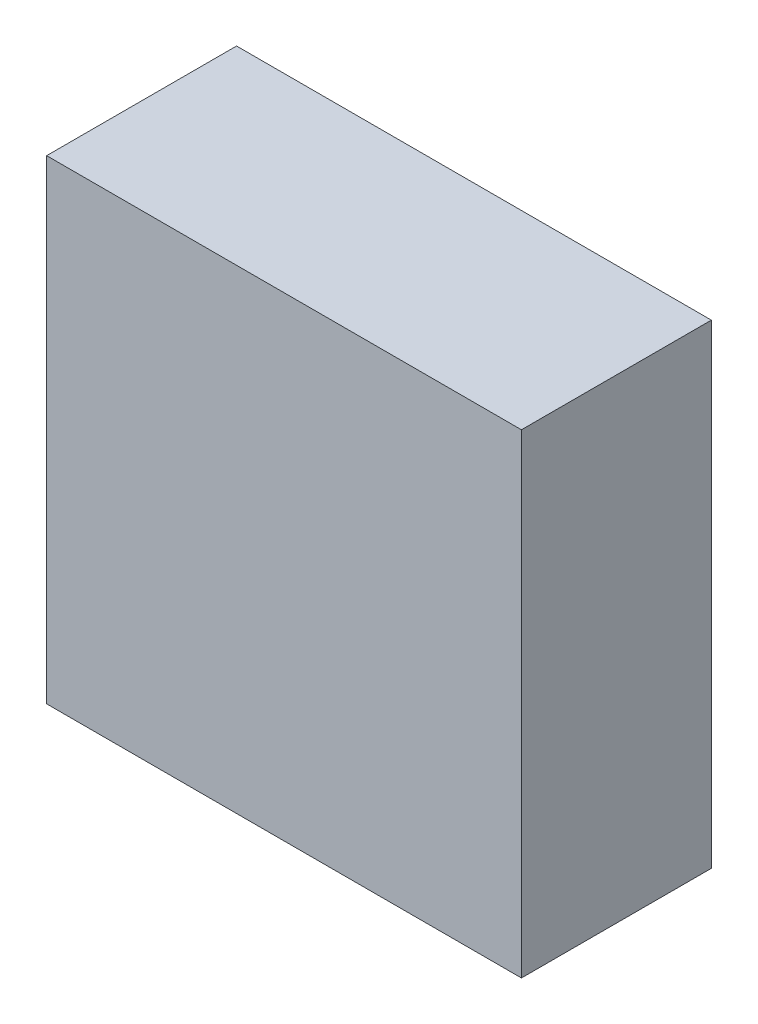
from build123d import *

# Parameters (mm, degrees)
SKETCH_1_W      = 50
SKETCH_1_H      = 50
EXTRUDE_1_DEPTH = 20


with BuildPart() as part:
    # 草图1 → 凸台-拉伸1 (new body)
    with BuildSketch(Plane.XY):
        with Locations((25, -25)):
            Rectangle(SKETCH_1_W, SKETCH_1_H)
    extrude(amount=EXTRUDE_1_DEPTH)


solid = part.part
